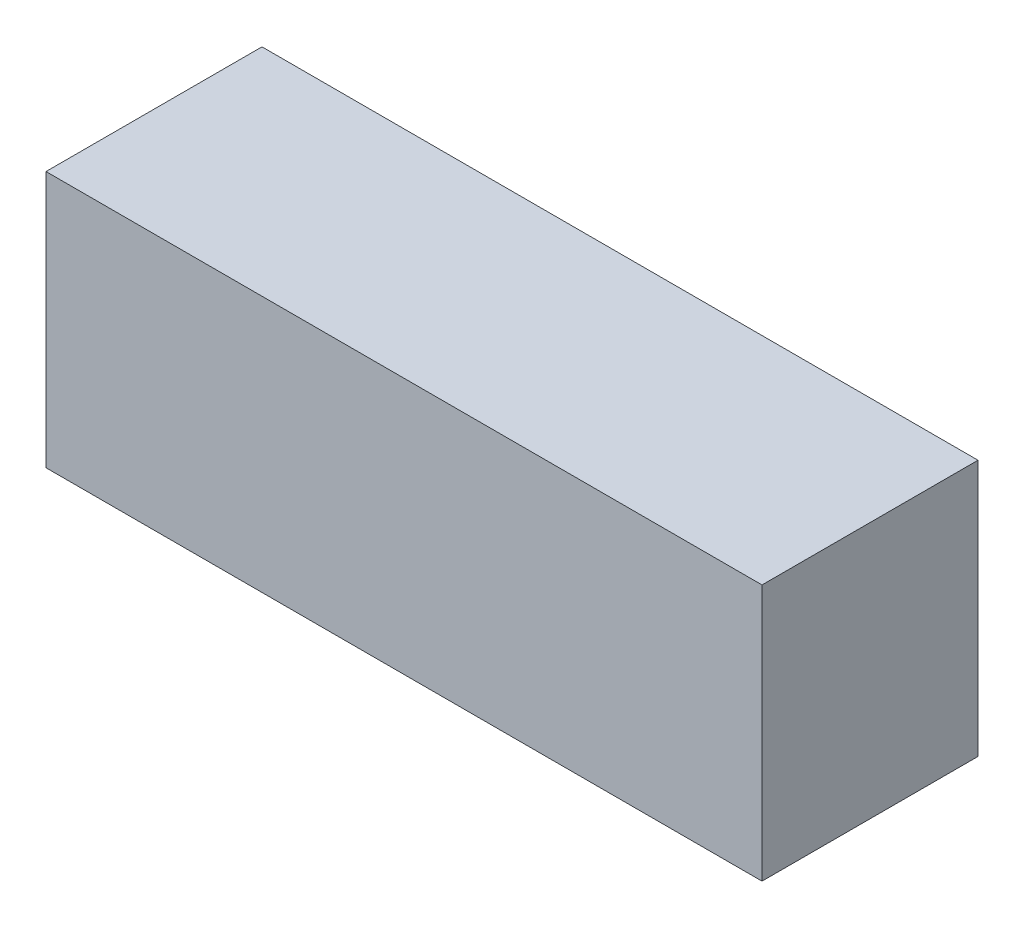
from build123d import *

# Parameters (mm, degrees)
SKETCH1_W           = 138.938
SKETCH1_H           = 49.784
BOSS_EXTRUDE1_DEPTH = 41.91


with BuildPart() as part:
    # Sketch1 → Boss-Extrude1 (new body)
    with BuildSketch(Plane.XY):
        Rectangle(SKETCH1_W, SKETCH1_H)
    extrude(amount=BOSS_EXTRUDE1_DEPTH)


solid = part.part
